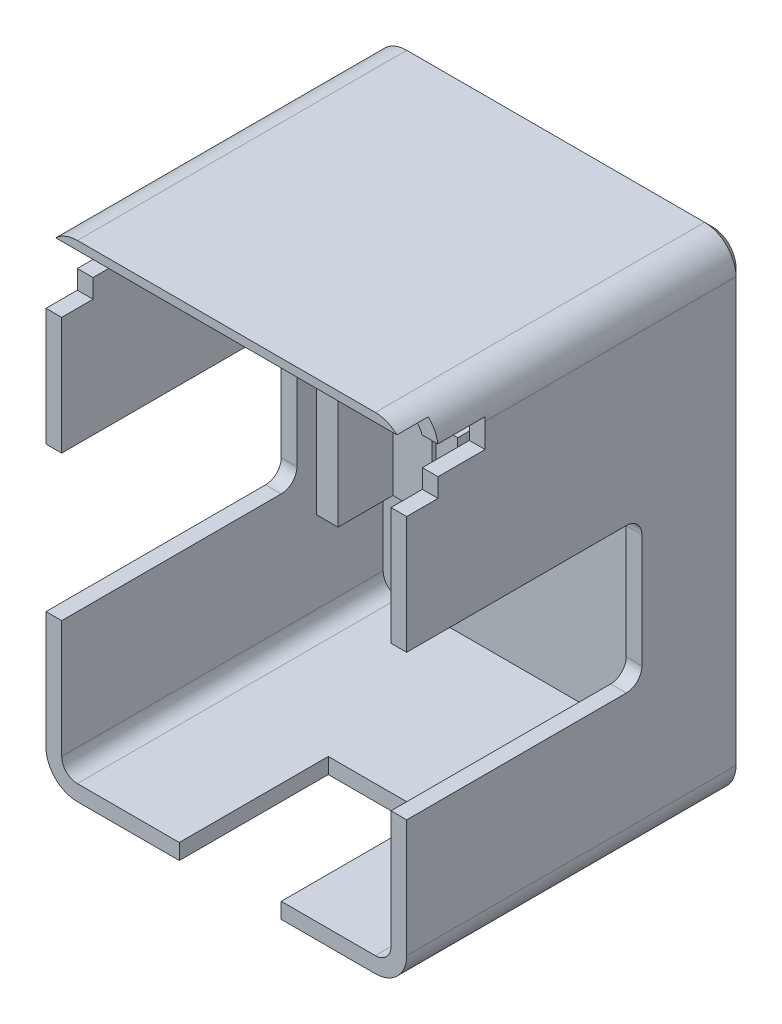
from build123d import *

# Parameters (mm, degrees)
BOSS_EXTRU_1_DEPTH      = 43
ENL_V_MAT_EXTRU_1_DEPTH = 41
ENL_V_MAT_EXTRU_2_DEPTH = 89.36854644
CHANFREIN1_SIZE         = 1
ENL_V_MAT_EXTRU_3_DEPTH = 89.36854644
ESQUISSE6_W             = 18
ESQUISSE6_H             = 23
BOSS_EXTRU_2_DEPTH      = 18.5
ENL_V_MAT_EXTRU_4_DEPTH = 7
ESQUISSE8_W             = 18
ESQUISSE8_H             = 2
ENL_V_MAT_EXTRU_5_DEPTH = 5.5
ESQUISSE9_W             = 13
ESQUISSE9_H             = 19
ENL_V_MAT_EXTRU_6_DEPTH = 3
CHANFREIN2_SIZE         = 0.5
ENL_V_START             = -11.5
ESQUISSE14_W            = 2.5
ESQUISSE14_H            = 17.5
ENL_V_MAT_EXTRU_7_DEPTH = 11.5
ESQUISSE15_W            = 5.5
ESQUISSE15_H            = 5.5
ESQUISSE15_W_2          = 6
ESQUISSE15_H_2          = 8.5
BOSS_EXTRU_4_DEPTH      = 15
CHANFREIN3_SIZE         = 7
CHANFREIN3_SIZE2        = 4.041451884
CHANFREIN4_SIZE         = 5
CHANFREIN4_SIZE2        = 2.886751346
ESQUISSE16_W            = 10
ESQUISSE16_H            = 8.5
BOSS_EXTRU_5_DEPTH      = 3.11325


with BuildPart() as part:
    # Esquisse1 → Boss.-Extru.1 (new body)
    with BuildSketch(Plane.XY):
        with BuildLine():
            Line((4, 0), (42, 0))
            ThreePointArc((42, 0), (44.828427125, 1.171572875), (46, 4))
            Line((46, 4), (46, 58))
            ThreePointArc((46, 58), (44.828427125, 60.828427125), (42, 62))
            Line((42, 62), (4, 62))
            ThreePointArc((4, 62), (1.171572875, 60.828427125), (0, 58))
            Line((0, 58), (0, 4))
            ThreePointArc((0, 4), (1.171572875, 1.171572875), (4, 0))
        make_face()
    extrude(amount=BOSS_EXTRU_1_DEPTH)

    # Esquisse3 → Enlèv. mat.-Extru.1 (cut)
    with BuildSketch(Plane.XY.offset(43)):
        with BuildLine():
            Line((2, 58), (2, 4))
            ThreePointArc((2, 4), (2.585786438, 2.585786438), (4, 2))
            Line((4, 2), (42, 2))
            ThreePointArc((42, 2), (43.414213562, 2.585786438), (44, 4))
            Line((44, 4), (44, 58))
            ThreePointArc((44, 58), (43.414213562, 59.414213562), (42, 60))
            Line((42, 60), (4, 60))
            ThreePointArc((4, 60), (2.585786438, 59.414213562), (2, 58))
        make_face()
    extrude(amount=-ENL_V_MAT_EXTRU_1_DEPTH, mode=Mode.SUBTRACT)

    # Esquisse4 → Enlèv. mat.-Extru.2 (cut, through all)
    with BuildSketch(Plane(origin=(46, 0, 0), x_dir=(0, 0, -1), z_dir=(1, 0, 0))):
        Polygon((-58.508519511, 60.9), (-39, 60.9), (-39, 58.5), (-33, 58.5), (-33, 54.9), (-39, 54.9), (-39, 52.5), (-58.508519511, 52.5), align=None)
    extrude(amount=-ENL_V_MAT_EXTRU_2_DEPTH, mode=Mode.SUBTRACT)

    # Chanfrein1
    chanfrein1_edges = [part.edges().sort_by_distance(p)[0] for p in [
        (46, 31, 0),
        (44.828427125, 1.171572875, 0),
        (23, 0, 0),
        (1.171572875, 1.171572875, 0),
        (0, 31, 0),
        (1.171572875, 60.828427125, 0),
        (23, 62, 0),
        (44.828427125, 60.828427125, 0),
    ]]
    chamfer(chanfrein1_edges, length=CHANFREIN1_SIZE)

    # Esquisse5 → Enlèv. mat.-Extru.3 (cut, through all)
    with BuildSketch(Plane(origin=(46, 0, 0), x_dir=(0, 0, -1), z_dir=(1, 0, 0))):
        with BuildLine():
            Line((-61.896917985, 37.5), (-15, 37.5))
            ThreePointArc((-15, 37.5), (-13.585786438, 36.914213562), (-13, 35.5))
            Line((-13, 35.5), (-13, 21))
            ThreePointArc((-13, 21), (-13.585786438, 19.585786438), (-15, 19))
            Line((-15, 19), (-61.896917985, 19))
            Line((-61.896917985, 19), (-61.896917985, 37.5))
        make_face()
    extrude(amount=-ENL_V_MAT_EXTRU_3_DEPTH, mode=Mode.SUBTRACT)

    # Esquisse6 → Boss.-Extru.2 (add)
    with BuildSketch(Plane.XY.offset(2)):
        with Locations((21, 35.95)):
            Rectangle(ESQUISSE6_W, ESQUISSE6_H)
    extrude(amount=BOSS_EXTRU_2_DEPTH)

    # Esquisse7 → Enlèv. mat.-Extru.4 (cut)
    with BuildSketch(Plane.XY.offset(20.5)):
        Polygon((12, 41.95), (12, 47.45), (30, 47.45), (30, 41.95), (27.25, 41.95), (27.25, 24.45), (14.75, 24.45), (14.75, 41.95), align=None)
    extrude(amount=-ENL_V_MAT_EXTRU_4_DEPTH, mode=Mode.SUBTRACT)

    # Esquisse8 → Enlèv. mat.-Extru.5 (cut)
    with BuildSketch(Plane.XY.offset(13.5)):
        with Locations((21, 42.95)):
            Rectangle(ESQUISSE8_W, ESQUISSE8_H)
    extrude(amount=-ENL_V_MAT_EXTRU_5_DEPTH, mode=Mode.SUBTRACT)

    # Esquisse9 → Enlèv. mat.-Extru.6 (cut)
    with BuildSketch(Plane.XZ):
        with Locations((23.5, 33.5)):
            Rectangle(ESQUISSE9_W, ESQUISSE9_H)
    extrude(amount=-ENL_V_MAT_EXTRU_6_DEPTH, mode=Mode.SUBTRACT)

    # Chanfrein2
    chanfrein2_edges = [part.edges().sort_by_distance(p)[0] for p in [
        (21, 43.95, 13.5),
    ]]
    chamfer(chanfrein2_edges, length=CHANFREIN2_SIZE)

    # Esquisse14 → Enlèv. mat.-Extru.7 (cut)
    with BuildSketch(Plane.XY.offset(13.5).offset(ENL_V_START)):
        with Locations((21, 33.2)):
            Rectangle(ESQUISSE14_W, ESQUISSE14_H)
    extrude(amount=ENL_V_MAT_EXTRU_7_DEPTH, mode=Mode.SUBTRACT)

    # Esquisse15 → Boss.-Extru.4 (add)
    with BuildSketch(Plane.XY.offset(2)):
        with Locations((4.75, 57.25)):
            Rectangle(ESQUISSE15_W, ESQUISSE15_H)
        with Locations((41, 55.75)):
            Rectangle(ESQUISSE15_W_2, ESQUISSE15_H_2)
    extrude(amount=BOSS_EXTRU_4_DEPTH)

    # Chanfrein3
    chanfrein3_edges = [part.edges().sort_by_distance(p)[0] for p in [
        (7.5, 57.25, 17),
    ]]
    chanfrein3_side = [part.faces().sort_by_distance(p)[0] for p in [
        (7.5, 57.25, 9.5),
    ]]
    chamfer(chanfrein3_edges, length=CHANFREIN3_SIZE, length2=CHANFREIN3_SIZE2, reference=chanfrein3_side[0])

    # Chanfrein4
    chanfrein4_edges = [part.edges().sort_by_distance(p)[0] for p in [
        (38, 55.75, 17),
    ]]
    chanfrein4_side = [part.faces().sort_by_distance(p)[0] for p in [
        (38, 55.75, 9.5),
    ]]
    chamfer(chanfrein4_edges, length=CHANFREIN4_SIZE, length2=CHANFREIN4_SIZE2, reference=chanfrein4_side[0])

    # Esquisse16 → Boss.-Extru.5 (add)
    with BuildSketch(Plane.ZY.offset(-44)):
        with Locations((22, 55.75)):
            Rectangle(ESQUISSE16_W, ESQUISSE16_H)
    extrude(amount=BOSS_EXTRU_5_DEPTH)


solid = part.part
